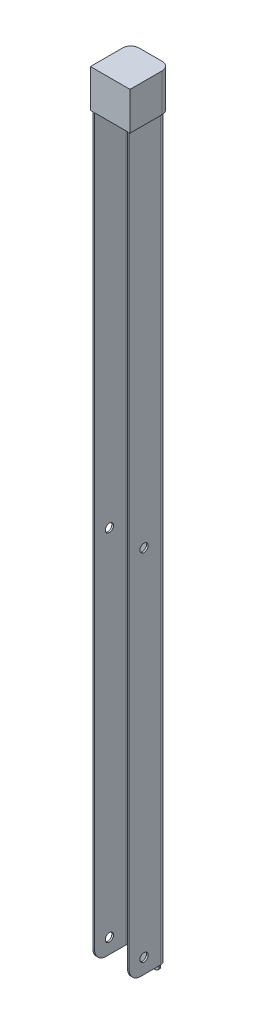
from build123d import *

# Parameters (mm, degrees)
EXTRUDE_1_DEPTH     = 470
FILLET_1_R          = 7
EXTRUDE_1_2_DEPTH   = 23
SKETCH_5_W          = 14
SKETCH_5_H          = 7
EXTRUDE_2_DEPTH     = 1
FILLET_2_R          = 2
SKETCH_3_R          = 2.5
CUT_EXTRUDE_1_DEPTH = 471.728424891


with BuildPart() as part:
    # Эскиз1 → Extrude 1 (new body)
    with BuildSketch(Plane(origin=(0, 0, 0), x_dir=(1, 0, 0), z_dir=(0, 1, 0))):
        with BuildLine():
            Line((11, -11.5), (11, 7.5))
            ThreePointArc((11, 7.5), (9.828427125, 10.328427125), (7, 11.5))
            Line((7, 11.5), (-7, 11.5))
            ThreePointArc((-7, 11.5), (-9.828427125, 10.328427125), (-11, 7.5))
            Line((-11, 7.5), (-11, -11.5))
            Line((-11, -11.5), (-10, -11.5))
            Line((-10, -11.5), (-10, 7.5))
            ThreePointArc((-10, 7.5), (-9.121320344, 9.621320344), (-7, 10.5))
            Line((-7, 10.5), (7, 10.5))
            ThreePointArc((7, 10.5), (9.121320344, 9.621320344), (10, 7.5))
            Line((10, 7.5), (10, -11.5))
            Line((10, -11.5), (11, -11.5))
        make_face()
    extrude(amount=EXTRUDE_1_DEPTH)

    # Скругление1
    fillet_1_edges = [part.edges().sort_by_distance(p)[0] for p in [
        (-10.5, 0, 11.5),
        (10.5, 0, 11.5),
    ]]
    fillet(fillet_1_edges, radius=FILLET_1_R)

    # Эскиз2 → Extrude 1 2 (add)
    with BuildSketch(Plane(origin=(0, 470, 0), x_dir=(1, 0, 0), z_dir=(0, 1, 0))):
        with BuildLine():
            Line((-12, -11.5), (-12, 7.5))
            ThreePointArc((-12, 7.5), (-10.535533906, 11.035533906), (-7, 12.5))
            Line((-7, 12.5), (7, 12.5))
            ThreePointArc((7, 12.5), (10.535533906, 11.035533906), (12, 7.5))
            Line((12, 7.5), (12, -11.5))
            Line((12, -11.5), (12, -12))
            Line((12, -12), (-12, -12))
            Line((-12, -12), (-12, -11.5))
        make_face()
    extrude(amount=-EXTRUDE_1_2_DEPTH)

    # Эскиз5 → Бобышка-Вытянуть2 (add)
    with BuildSketch(Plane(origin=(0, 0, -11.5), x_dir=(-1, 0, 0), z_dir=(0, 0, -1))):
        with Locations((0, -3.5)):
            Rectangle(SKETCH_5_W, SKETCH_5_H)
    extrude(amount=-EXTRUDE_2_DEPTH)

    # Скругление2
    fillet_2_edges = [part.edges().sort_by_distance(p)[0] for p in [
        (7, -7, -11),
        (-7, -7, -11),
    ]]
    fillet(fillet_2_edges, radius=FILLET_2_R)

    # Эскиз3 → Вырез-Вытянуть1 (cut, through all)
    with BuildSketch(Plane.ZY.offset(11)):
        with Locations((2.5, 9)):
            Circle(SKETCH_3_R)
        with Locations((2.5, 224)):
            Circle(SKETCH_3_R)
    extrude(amount=-CUT_EXTRUDE_1_DEPTH, mode=Mode.SUBTRACT)


solid = part.part
